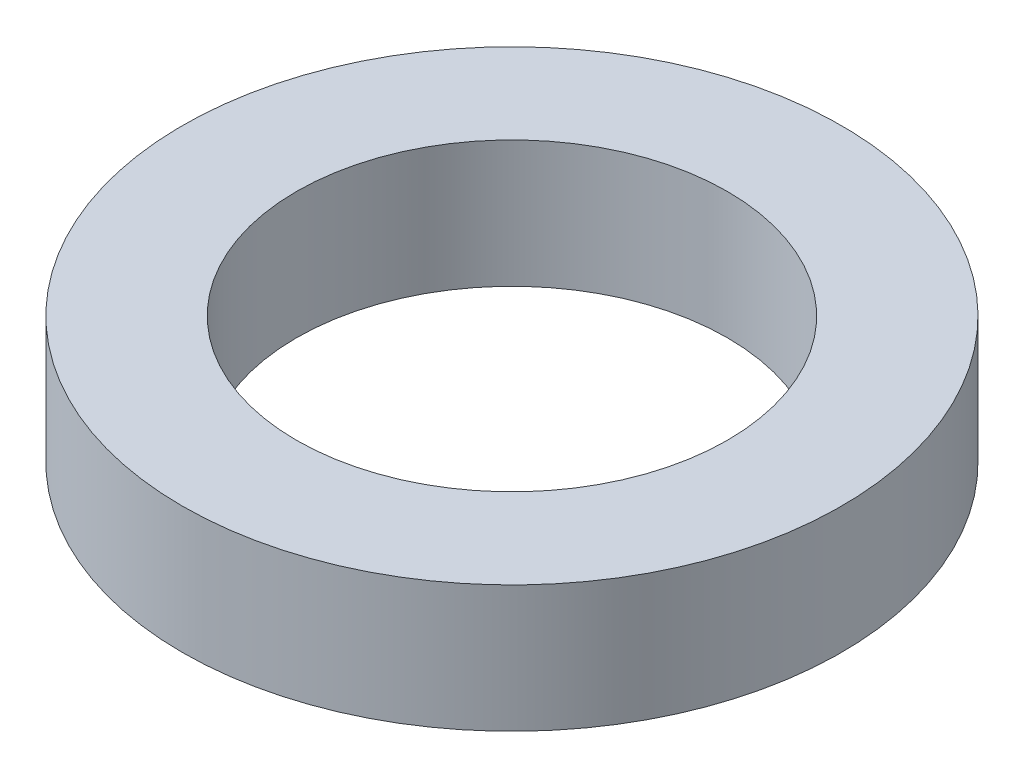
from build123d import *

# Parameters (mm, degrees)
SKETCH1_R           = 13
SKETCH1_R_2         = 8.5
BOSS_EXTRUDE1_DEPTH = 5


with BuildPart() as part:
    # Sketch1 → Boss-Extrude1 (new body)
    with BuildSketch(Plane(origin=(0, 0, 0), x_dir=(1, 0, 0), z_dir=(0, 1, 0))):
        with Locations(Location((0, 0, 0), (0, 0, 270))):
            Circle(SKETCH1_R)
        with Locations(Location((0, 0, 0), (0, 0, 270))):
            Circle(SKETCH1_R_2, mode=Mode.SUBTRACT)
    extrude(amount=BOSS_EXTRUDE1_DEPTH)


solid = part.part
